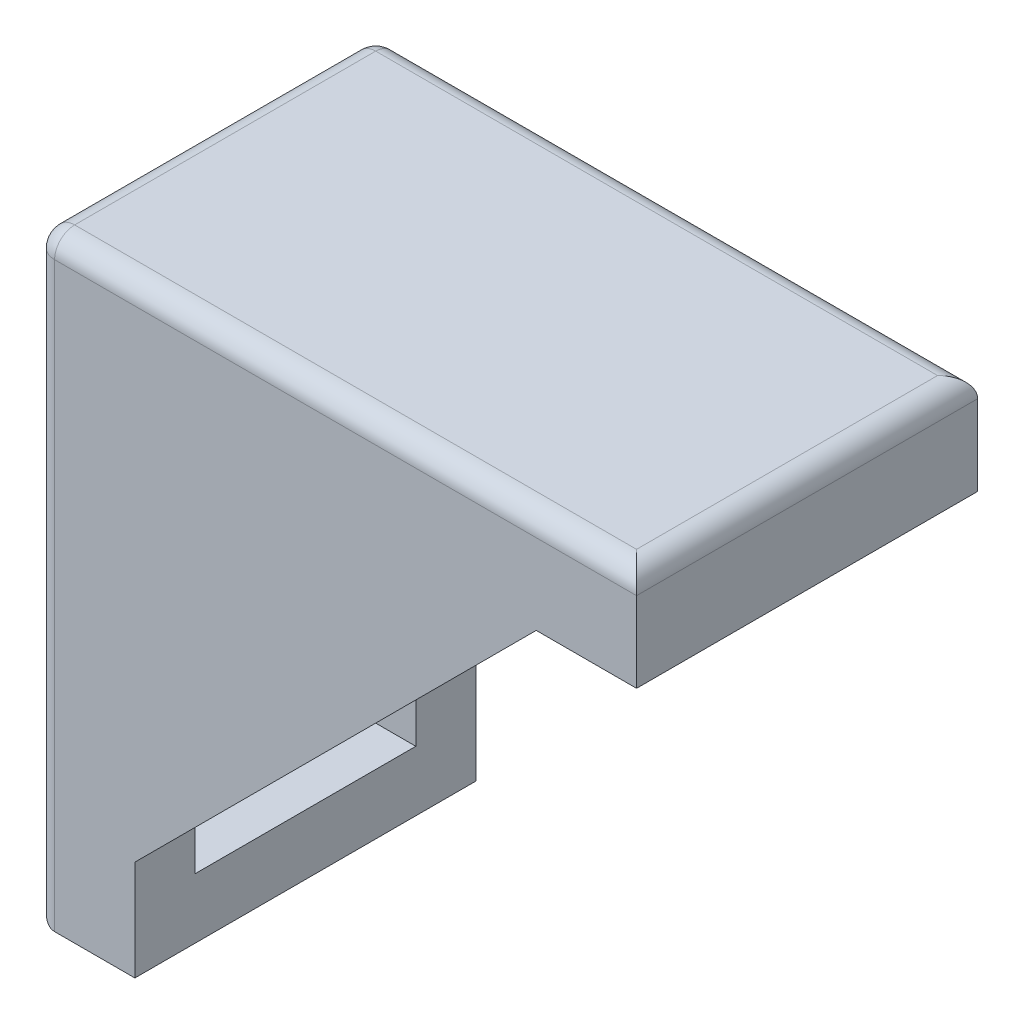
from build123d import *

# Parameters (mm, degrees)
BOSS_EXTRUDE1_DEPTH = 17
FILLET1_R           = 1
SHELL1_T            = -3


with BuildPart() as part:
    # Sketch1 → Boss-Extrude1 (new body)
    with BuildSketch(Plane.XY):
        Polygon((0, 0), (30, 0), (30, -5), (25, -5), (5, -25), (5, -30), (0, -30), align=None)
    extrude(amount=-BOSS_EXTRUDE1_DEPTH)

    # Fillet1
    fillet1_edges = [part.edges().sort_by_distance(p)[0] for p in [
        (0, 0, -8.5),
        (30, 0, -8.5),
        (0, -30, -8.5),
        (15, 0, -17),
        (0, -15, -17),
        (15, 0, 0),
        (0, -15, 0),
    ]]
    fillet(fillet1_edges, radius=FILLET1_R)

    # Shell1
    shell1_openings = [part.faces().sort_by_distance(p)[0] for p in [
        (27.5, -5, -8.5),
        (15, -15, -8.5),
        (5, -27.5, -8.5),
    ]]
    offset(amount=SHELL1_T, openings=shell1_openings)


solid = part.part
